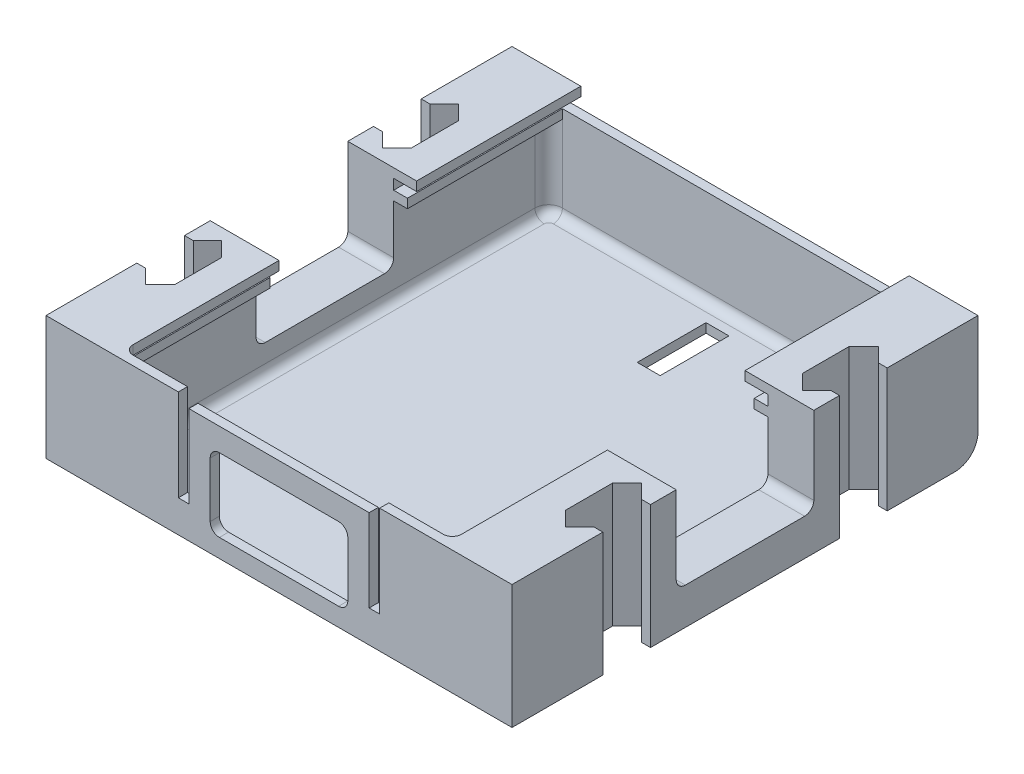
from build123d import *

# Parameters (mm, degrees)
SKETCH1_W                 = 101.6
SKETCH1_H                 = 101.6
BOSS_EXTRUDE1_DEPTH       = 25
SHELL1_T                  = -2
SHELL1_THICKNESS_2_FACE_W = 97.6
SHELL1_THICKNESS_2_FACE_H = 23
SHELL1_THICKNESS_2_DEPTH  = 8
SHELL1_THICKNESS_3_FACE_W = 97.6
SHELL1_THICKNESS_3_FACE_H = 23
SHELL1_THICKNESS_3_DEPTH  = 8
SKETCH2_W                 = 5
SKETCH2_H                 = 15
CUT_EXTRUDE1_DEPTH        = 25
CUT_EXTRUDE2_DEPTH        = 117.310790557
FILLET2_R                 = 3
FILLET3_R                 = 2
CUT_EXTRUDE4_DEPTH        = 77.067601513
CUT_EXTRUDE7_START        = -99.6
SKETCH11_W                = 2.3
SKETCH11_H                = 18
CUT_EXTRUDE7_DEPTH        = 17.710790557
SKETCH12_W                = 81.6
SKETCH12_H                = 2.25
CUT_EXTRUDE8_DEPTH        = 10
BOSS_EXTRUDE2_DEPTH       = 2
BOSS_EXTRUDE3_DEPTH       = 2
FILLET4_R                 = 2
FILLET4_OF_MIRROR1_R      = 2
FILLET5_R                 = 5


with BuildPart() as part:
    # Sketch1 → Boss-Extrude1 (new body)
    with BuildSketch(Plane(origin=(0, 0, 0), x_dir=(1, 0, 0), z_dir=(0, 1, 0))):
        Rectangle(SKETCH1_W, SKETCH1_H)
    extrude(amount=BOSS_EXTRUDE1_DEPTH)

    # Shell1
    shell1_openings = [part.faces().sort_by_distance(p)[0] for p in [
        (0, 25, 0),
    ]]
    offset(amount=SHELL1_T, openings=shell1_openings, kind=Kind.INTERSECTION)

    # Shell1 thickness 2 face (on inner face of the shell) → Shell1 thickness 2 (add)
    with BuildSketch(Plane(origin=(48.8, 13.5, 0), x_dir=(0, 0, 1), z_dir=(1, 0, 0))):
        Rectangle(SHELL1_THICKNESS_2_FACE_W, SHELL1_THICKNESS_2_FACE_H)
    extrude(amount=-SHELL1_THICKNESS_2_DEPTH)

    # Shell1 thickness 3 face (on inner face of the shell) → Shell1 thickness 3 (add)
    with BuildSketch(Plane(origin=(-48.8, 13.5, 0), x_dir=(0, 0, -1), z_dir=(-1, 0, 0))):
        Rectangle(SHELL1_THICKNESS_3_FACE_W, SHELL1_THICKNESS_3_FACE_H)
    extrude(amount=-SHELL1_THICKNESS_3_DEPTH)

    # Sketch2 → Cut-Extrude1 (cut)
    with BuildSketch(Plane(origin=(0, 2, 0), x_dir=(1, 0, 0), z_dir=(0, 1, 0))):
        with Locations((0, 37.3)):
            Rectangle(SKETCH2_W, SKETCH2_H)
    extrude(amount=-CUT_EXTRUDE1_DEPTH, mode=Mode.SUBTRACT)

    # Sketch3 → Cut-Extrude2 (cut, through all)
    with BuildSketch(Plane(origin=(50.8, 0, 0), x_dir=(0, 0, -1), z_dir=(1, 0, 0))):
        with BuildLine():
            Line((-15, 42), (15, 42))
            Line((15, 42), (15, 10))
            ThreePointArc((15, 10), (14.414213562, 8.585786438), (13, 8))
            Line((13, 8), (-13, 8))
            ThreePointArc((-13, 8), (-14.414213562, 8.585786438), (-15, 10))
            Line((-15, 10), (-15, 42))
        make_face()
    extrude(amount=-CUT_EXTRUDE2_DEPTH, mode=Mode.SUBTRACT)

    # Fillet2
    fillet2_edges = [part.edges().sort_by_distance(p)[0] for p in [
        (-40.8, 13.5, -48.8),
        (-40.8, 13.5, 48.8),
        (40.8, 13.5, 48.8),
        (40.8, 13.5, -48.8),
    ]]
    fillet(fillet2_edges, radius=FILLET2_R)

    # Fillet3
    fillet3_edges = [part.edges().sort_by_distance(p)[0] for p in [
        (40.8, 2, 0),
        (-40.8, 2, 0),
        (0, 2, 48.8),
        (0, 2, -48.8),
        (-39.921320344, 2, -47.921320344),
        (-39.921320344, 2, 47.921320344),
        (39.921320344, 2, 47.921320344),
        (39.921320344, 2, -47.921320344),
    ]]
    fillet(fillet3_edges, radius=FILLET3_R)

    # Sketch7 → Cut-Extrude4 (cut, through all)
    with BuildSketch(Plane(origin=(0, 25, 0), x_dir=(1, 0, 0), z_dir=(0, 1, 0))):
        Polygon((51, -31), (48.882842712, -31), (45.8, -34.082842712), (42.6, -30.882842712), (42.6, -20.717157288), (45.8, -17.517157288), (48.882842712, -20.6), (51, -20.6), align=None)
        Polygon((-51, -20.6), (-51, -31), (-48.882842712, -31), (-45.8, -34.082842712), (-42.6, -30.882842712), (-42.6, -20.717157288), (-45.8, -17.517157288), (-48.882842712, -20.6), align=None)
        Polygon((-51, 31), (-48.882842712, 31), (-45.8, 34.082842712), (-42.6, 30.882842712), (-42.6, 20.717157288), (-45.8, 17.517157288), (-48.882842712, 20.6), (-51, 20.6), align=None)
        Polygon((51, 20.6), (51, 31), (48.882842712, 31), (45.8, 34.082842712), (42.6, 30.882842712), (42.6, 20.717157288), (45.8, 17.517157288), (48.882842712, 20.6), align=None)
    extrude(amount=-CUT_EXTRUDE4_DEPTH, mode=Mode.SUBTRACT)

    # Sketch11 → Cut-Extrude7 (cut, through all)
    with BuildSketch(Plane(origin=(0, 0, -50.8), x_dir=(-1, 0, 0), z_dir=(0, 0, -1)).offset(CUT_EXTRUDE7_START)):
        with Locations((-20.8, 16)):
            Rectangle(SKETCH11_W, SKETCH11_H)
        with Locations((20.8, 16)):
            Rectangle(SKETCH11_W, SKETCH11_H)
        with BuildLine():
            Line((-13, 4), (13, 4))
            ThreePointArc((13, 4), (14.414213562, 4.585786438), (15, 6))
            Line((15, 6), (15, 18))
            ThreePointArc((15, 18), (14.414213562, 19.414213562), (13, 20))
            Line((13, 20), (-13, 20))
            ThreePointArc((-13, 20), (-14.414213562, 19.414213562), (-15, 18))
            Line((-15, 18), (-15, 6))
            ThreePointArc((-15, 6), (-14.414213562, 4.585786438), (-13, 4))
        make_face()
    extrude(amount=-CUT_EXTRUDE7_DEPTH, mode=Mode.SUBTRACT)

    # Sketch12 → Cut-Extrude8 (cut)
    with BuildSketch(Plane(origin=(0, 0, -50.8), x_dir=(-1, 0, 0), z_dir=(0, 0, -1))):
        with Locations((0, 23.875)):
            Rectangle(SKETCH12_W, SKETCH12_H)
    extrude(amount=-CUT_EXTRUDE8_DEPTH, mode=Mode.SUBTRACT)

    # Sketch13 → Boss-Extrude2 (add)
    with BuildSketch(Plane(origin=(0, 22.75, 0), x_dir=(1, 0, 0), z_dir=(0, 1, 0))):
        with BuildLine():
            Line((40.8, 45.8), (40.8, 15))
            Line((40.8, 15), (37.8, 15))
            Line((37.8, 15), (37.8, 48.8))
            ThreePointArc((37.8, 48.8), (39.921320344, 47.921320344), (40.8, 45.8))
        make_face()
        with BuildLine():
            Line((40.8, -45.8), (40.8, -15))
            Line((40.8, -15), (37.8, -15))
            Line((37.8, -15), (37.8, -48.8))
            ThreePointArc((37.8, -48.8), (39.921320344, -47.921320344), (40.8, -45.8))
        make_face()
    boss_extrude2 = extrude(amount=-BOSS_EXTRUDE2_DEPTH)

    # Sketch14 → Boss-Extrude3 (add)
    with BuildSketch(Plane(origin=(0, 25, 0), x_dir=(1, 0, 0), z_dir=(0, 1, 0))):
        Polygon((50.8, 50.8), (35.8, 50.8), (35.8, 15), (50.8, 15), (50.8, 20.6), (48.882842712, 20.6), (45.8, 17.517157288), (42.6, 20.717157288), (42.6, 30.882842712), (45.8, 34.082842712), (48.882842712, 31), (50.8, 31), align=None)
        Polygon((21.95, -50.8), (21.95, -48.8), (35.8, -48.8), (35.8, -15), (50.8, -15), (50.8, -20.6), (48.882842712, -20.6), (45.8, -17.517157288), (42.6, -20.717157288), (42.6, -30.882842712), (45.8, -34.082842712), (48.882842712, -31), (50.8, -31), (50.8, -50.8), align=None)
    boss_extrude3 = extrude(amount=BOSS_EXTRUDE3_DEPTH)

    # Fillet4
    fillet4_edges = [part.edges().sort_by_distance(p)[0] for p in [
        (35.8, 26, 48.8),
    ]]
    fillet(fillet4_edges, radius=FILLET4_R)

    # Mirror1: Boss-Extrude2, Boss-Extrude3 across plane
    add(boss_extrude2.mirror(Plane(origin=(0, 0, 0), x_dir=(0, 0, 1), z_dir=(1, 0, 0))))
    add(boss_extrude3.mirror(Plane(origin=(0, 0, 0), x_dir=(0, 0, 1), z_dir=(1, 0, 0))))

    # Fillet4 of Mirror1
    fillet4_of_mirror1_edges = [part.edges().sort_by_distance(p)[0] for p in [
        (-35.8, 26, 48.8),
    ]]
    fillet(fillet4_of_mirror1_edges, radius=FILLET4_OF_MIRROR1_R)

    # Fillet5
    fillet5_edges = [part.edges().sort_by_distance(p)[0] for p in [
        (0, 0, -50.8),
    ]]
    fillet(fillet5_edges, radius=FILLET5_R)


solid = part.part
